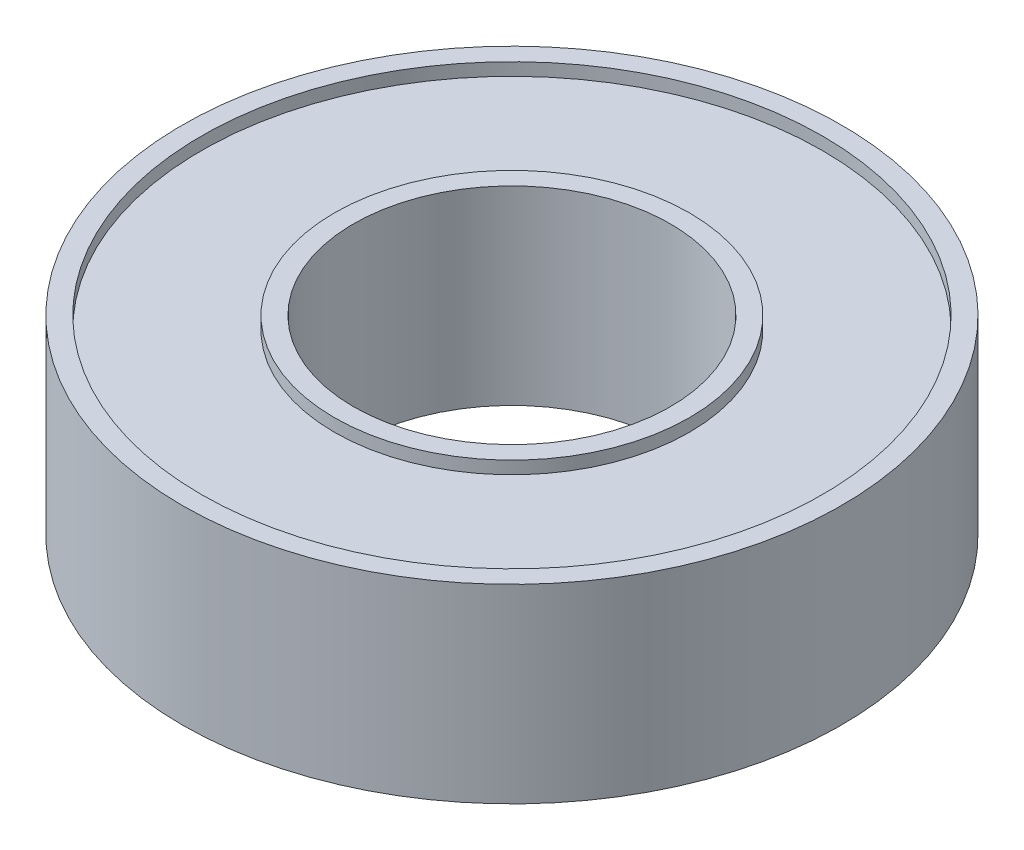
from build123d import *

# Parameters (mm, degrees)
CROQUIS1_R              = 26
CROQUIS1_R_2            = 12.5
SALIENTE_EXTRUIR1_DEPTH = 15
CROQUIS2_R              = 24.5
CROQUIS2_R_2            = 14
CORTAR_EXTRUIR1_DEPTH   = 1
CORTAR_EXTRUIR3_START   = -1
CROQUIS3_R              = 24.5
CROQUIS3_R_2            = 14
CORTAR_EXTRUIR3_DEPTH   = 1


with BuildPart() as part:
    # Croquis1 → Saliente-Extruir1 (new body)
    with BuildSketch(Plane(origin=(0, 0, 0), x_dir=(1, 0, 0), z_dir=(0, 1, 0))):
        with Locations(Location((0, 0, 0), (0, 0, 270))):
            Circle(CROQUIS1_R)
        with Locations(Location((0, 0, 0), (0, 0, 270))):
            Circle(CROQUIS1_R_2, mode=Mode.SUBTRACT)
    extrude(amount=SALIENTE_EXTRUIR1_DEPTH)

    # Croquis2 → Cortar-Extruir1 (cut)
    with BuildSketch(Plane(origin=(0, 15, 0), x_dir=(1, 0, 0), z_dir=(0, 1, 0))):
        with Locations(Location((0, 0, 0), (0, 0, 270))):
            Circle(CROQUIS2_R)
        with Locations(Location((0, 0, 0), (0, 0, 270))):
            Circle(CROQUIS2_R_2, mode=Mode.SUBTRACT)
    extrude(amount=-CORTAR_EXTRUIR1_DEPTH, mode=Mode.SUBTRACT)

    # Croquis3 → Cortar-Extruir3 (cut)
    with BuildSketch(Plane.XZ.offset(CORTAR_EXTRUIR3_START)):
        with Locations(Location((0, 0, 0), (0, 0, 90))):
            Circle(CROQUIS3_R)
        with Locations(Location((0, 0, 0), (0, 0, 90))):
            Circle(CROQUIS3_R_2, mode=Mode.SUBTRACT)
    extrude(amount=CORTAR_EXTRUIR3_DEPTH, mode=Mode.SUBTRACT)


solid = part.part
